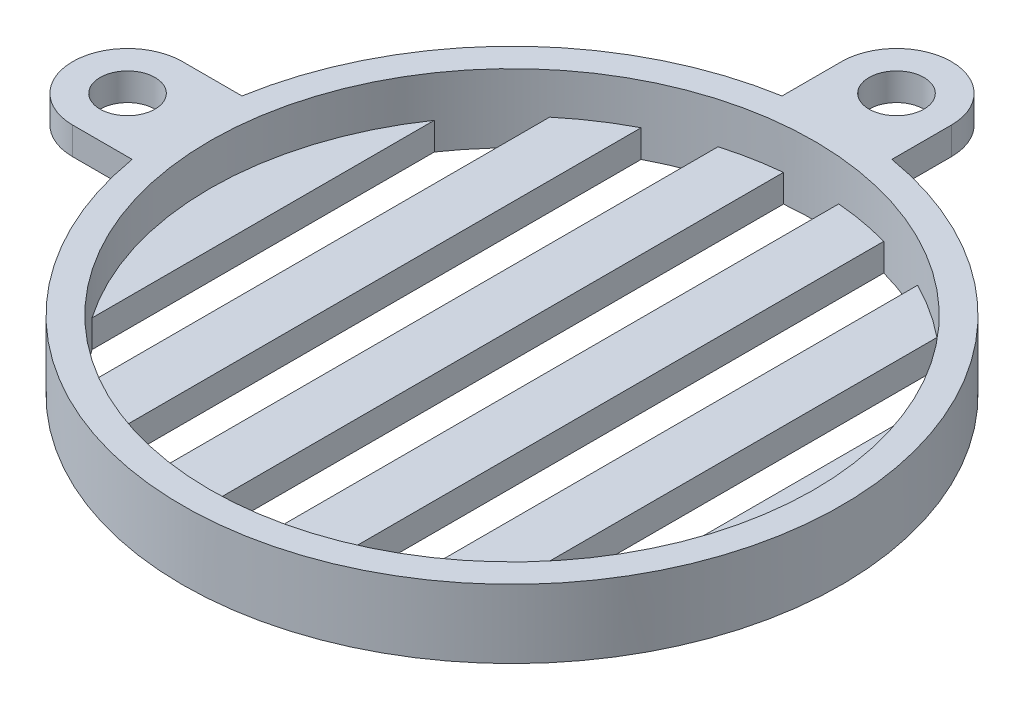
from build123d import *

# Parameters (mm, degrees)
SKETCH1_R           = 24
SKETCH1_R_2         = 22
BOSS_EXTRUDE1_DEPTH = 5
BOSS_EXTRUDE2_DEPTH = 2
SKETCH3_R           = 2
BOSS_EXTRUDE3_DEPTH = 2


with BuildPart() as part:
    # Sketch1 → Boss-Extrude1 (new body)
    with BuildSketch(Plane(origin=(0, 0, 0), x_dir=(1, 0, 0), z_dir=(0, 1, 0))):
        with Locations(Location((0, 0, 0), (0, 0, 270))):
            Circle(SKETCH1_R)
        with Locations(Location((0, 0, 0), (0, 0, 270))):
            Circle(SKETCH1_R_2, mode=Mode.SUBTRACT)
    extrude(amount=BOSS_EXTRUDE1_DEPTH)

    # Sketch2 → Boss-Extrude2 (add)
    with BuildSketch(Plane.XZ):
        with BuildLine():
            Line((-18.126828112, 12.833489636), (-18.126828112, 15.729529636))
            ThreePointArc((-18.126828112, 15.729529636), (-24, 0), (-18.126828112, -15.729529636))
            Line((-18.126828112, -15.729529636), (-18.126828112, -12.833489636))
            ThreePointArc((-18.126828112, -12.833489636), (-22.209915661, 0), (-18.126828112, 12.833489636))
        make_face()
        with BuildLine():
            Line((-18.126828112, -12.466679694), (-18.126828112, 12.466679694))
            ThreePointArc((-18.126828112, 12.466679694), (-22, 0), (-18.126828112, -12.466679694))
        make_face()
        with BuildLine():
            ThreePointArc((-10.126828112, 19.530677213), (-12.199845938, 18.307478229), (-14.126828112, 16.865133485))
            Line((-14.126828112, 16.865133485), (-14.126828112, -16.865133485))
            ThreePointArc((-14.126828112, -16.865133485), (-12.199845938, -18.307478229), (-10.126828112, -19.530677213))
            Line((-10.126828112, -19.530677213), (-10.126828112, 19.530677213))
        make_face()
        with BuildLine():
            ThreePointArc((-2.126828112, 21.896954176), (-4.14462307, 21.606066269), (-6.126828112, 21.12964688))
            Line((-6.126828112, 21.12964688), (-6.126828112, -21.12964688))
            ThreePointArc((-6.126828112, -21.12964688), (-4.14462307, -21.606066269), (-2.126828112, -21.896954176))
            Line((-2.126828112, -21.896954176), (-2.126828112, 21.896954176))
        make_face()
        with BuildLine():
            ThreePointArc((5.873171888, 21.201553056), (3.889799677, 21.653393694), (1.873171888, 21.920110106))
            Line((1.873171888, 21.920110106), (1.873171888, -21.920110106))
            ThreePointArc((1.873171888, -21.920110106), (3.889799677, -21.653393694), (5.873171888, -21.201553056))
            Line((5.873171888, -21.201553056), (5.873171888, 21.201553056))
        make_face()
        with BuildLine():
            ThreePointArc((13.873171888, 17.074399017), (11.943353973, 18.475830045), (9.873171888, 19.66012403))
            Line((9.873171888, 19.66012403), (9.873171888, -19.66012403))
            ThreePointArc((9.873171888, -19.66012403), (11.943353973, -18.475830045), (13.873171888, -17.074399017))
            Line((13.873171888, -17.074399017), (13.873171888, 17.074399017))
        make_face()
        with BuildLine():
            ThreePointArc((22, 0), (20.94289595, 6.737589275), (17.873171888, 12.82769374))
            Line((17.873171888, 12.82769374), (17.873171888, -12.82769374))
            ThreePointArc((17.873171888, -12.82769374), (20.94289595, -6.737589275), (22, 0))
        make_face()
    extrude(amount=-BOSS_EXTRUDE2_DEPTH)

    # Sketch3 → Boss-Extrude3 (add)
    # profile 1 of 2: a face of its own
    with BuildSketch(Plane(origin=(0, 5, 0), x_dir=(1, 0, 0), z_dir=(0, 1, 0))):
        with BuildLine():
            Line((-28, 4), (-22.866655367, 4))
            Line((-22.866655367, 4), (-22.866655367, -4))
            Line((-22.866655367, -4), (-28, -4))
            ThreePointArc((-28, -4), (-32, 0), (-28, 4))
        make_face()
        with Locations(Location((-28, 0, 0), (0, 0, 270))):
            Circle(SKETCH3_R, mode=Mode.SUBTRACT)
    # profile 2 of 2: a face of its own
    with BuildSketch(Plane(origin=(0, 5, 0), x_dir=(1, 0, 0), z_dir=(0, 1, 0))):
        with BuildLine():
            Line((-4, 22.866655367), (-4, 28))
            ThreePointArc((-4, 28), (0, 32), (4, 28))
            Line((4, 28), (4, 22.866655367))
            Line((4, 22.866655367), (-4, 22.866655367))
        make_face()
        with Locations(Location((0, 28, 0), (0, 0, 270))):
            Circle(SKETCH3_R, mode=Mode.SUBTRACT)
    extrude(amount=-BOSS_EXTRUDE3_DEPTH)


solid = part.part
